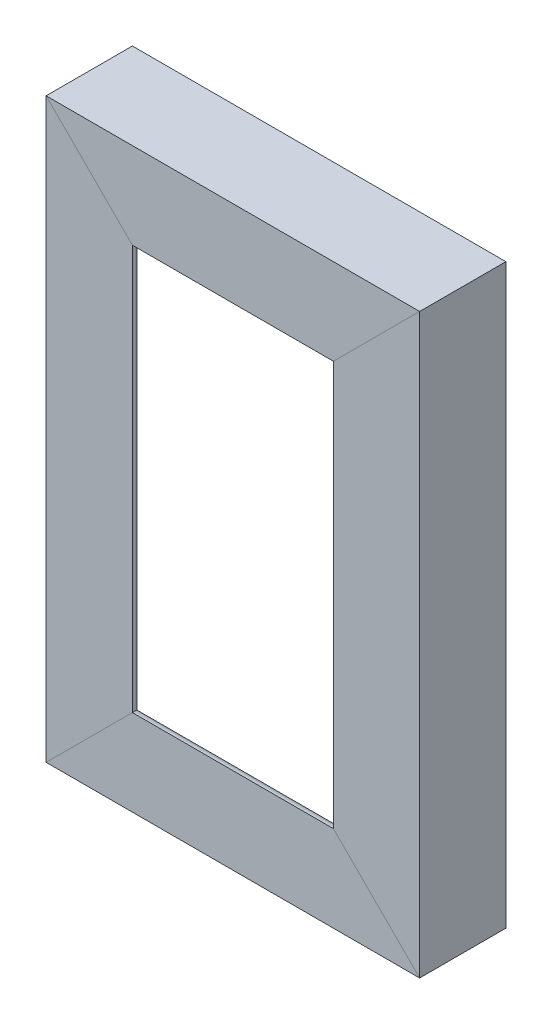
from build123d import *

# Parameters (mm, degrees)
HIERRO_ANGULAR_1_X_1_X_0_125_1_DEPTH      = 206.921024484
HIERRO_ANGULAR_1_X_1_X_0_125_1_DEPTH_BACK = 36.921024484
HIERRO_ANGULAR_1_X_1_X_0_125_1_2_DEPTH    = 183.842048969
HIERRO_ANGULAR_1_X_1_X_0_125_1_3_DEPTH    = 243.842048969
HIERRO_ANGULAR_1_X_1_X_0_125_1_4_DEPTH    = 183.842048969


with BuildPart() as part:
    # Sketch1 → Hierro angular 1 X 1 X 0.125(1) (new, two sides: drawn at the far end of the back side and taken through both)
    with BuildSketch(Plane(origin=(-55, -85, 0), x_dir=(1, 0, 0), z_dir=(0, 1, 0)).offset(-HIERRO_ANGULAR_1_X_1_X_0_125_1_DEPTH_BACK)):
        with BuildLine():
            Line((0, 0), (0, 25.4))
            Line((0, 25.4), (0.00508, 25.4))
            ThreePointArc((0.00508, 25.4), (2.246551928, 24.471551928), (3.175, 22.23008))
            Line((3.175, 22.23008), (3.175, 7.9375))
            ThreePointArc((3.175, 7.9375), (4.569903955, 4.569903955), (7.9375, 3.175))
            Line((7.9375, 3.175), (22.23008, 3.175))
            ThreePointArc((22.23008, 3.175), (24.471551928, 2.246551928), (25.4, 0.00508))
            Line((25.4, 0.00508), (25.4, 0))
            Line((25.4, 0), (0, 0))
        make_face()
    extrude(amount=HIERRO_ANGULAR_1_X_1_X_0_125_1_DEPTH + HIERRO_ANGULAR_1_X_1_X_0_125_1_DEPTH_BACK)

    # Hierro angular 1 X 1 X 0.125(1) mitre 1
    split(bisect_by=Plane(origin=(-55, -85, 0), x_dir=(-0.707106781, -0.707106781, 0), z_dir=(-0.707106781, 0.707106781, 0)), keep=Keep.TOP)

    # Hierro angular 1 X 1 X 0.125(1) mitre 2
    split(bisect_by=Plane(origin=(-55, 85, 0), x_dir=(0.707106781, -0.707106781, 0), z_dir=(-0.707106781, -0.707106781, 0)), keep=Keep.TOP)


with BuildPart() as body_2:
    # Sketch1 on segment 2 (carried to segment 2) → Hierro angular 1 X 1 X 0.125_1 2 (new body)
    with BuildSketch(Plane(origin=(-91.921024484, 85, 0), x_dir=(0, -1, 0), z_dir=(1, 0, 0))):
        with BuildLine():
            Line((0, 0), (0, 25.4))
            Line((0, 25.4), (0.00508, 25.4))
            ThreePointArc((0.00508, 25.4), (2.246551928, 24.471551928), (3.175, 22.23008))
            Line((3.175, 22.23008), (3.175, 7.9375))
            ThreePointArc((3.175, 7.9375), (4.569903955, 4.569903955), (7.9375, 3.175))
            Line((7.9375, 3.175), (22.23008, 3.175))
            ThreePointArc((22.23008, 3.175), (24.471551928, 2.246551928), (25.4, 0.00508))
            Line((25.4, 0.00508), (25.4, 0))
            Line((25.4, 0), (0, 0))
        make_face()
    extrude(amount=HIERRO_ANGULAR_1_X_1_X_0_125_1_2_DEPTH)

    # Hierro angular 1 X 1 X 0.125_1 2 mitre 1
    split(bisect_by=Plane(origin=(55, 85, 0), x_dir=(-0.707106781, -0.707106781, 0), z_dir=(-0.707106781, 0.707106781, 0)), keep=Keep.TOP)

    # Hierro angular 1 X 1 X 0.125_1 2 mitre 2
    split(bisect_by=Plane(origin=(-55, 85, 0), x_dir=(-0.707106781, 0.707106781, 0), z_dir=(0.707106781, 0.707106781, 0)), keep=Keep.TOP)


with BuildPart() as body_3:
    # Sketch1 on segment 3 (carried to segment 3) → Hierro angular 1 X 1 X 0.125_1 3 (new body)
    with BuildSketch(Plane(origin=(55, 121.921024484, 0), x_dir=(-1, 0, 0), z_dir=(0, -1, 0))):
        with BuildLine():
            Line((0, 0), (0, 25.4))
            Line((0, 25.4), (0.00508, 25.4))
            ThreePointArc((0.00508, 25.4), (2.246551928, 24.471551928), (3.175, 22.23008))
            Line((3.175, 22.23008), (3.175, 7.9375))
            ThreePointArc((3.175, 7.9375), (4.569903955, 4.569903955), (7.9375, 3.175))
            Line((7.9375, 3.175), (22.23008, 3.175))
            ThreePointArc((22.23008, 3.175), (24.471551928, 2.246551928), (25.4, 0.00508))
            Line((25.4, 0.00508), (25.4, 0))
            Line((25.4, 0), (0, 0))
        make_face()
    extrude(amount=HIERRO_ANGULAR_1_X_1_X_0_125_1_3_DEPTH)

    # Hierro angular 1 X 1 X 0.125_1 3 mitre 1
    split(bisect_by=Plane(origin=(55, -85, 0), x_dir=(-0.707106781, 0.707106781, 0), z_dir=(0.707106781, 0.707106781, 0)), keep=Keep.TOP)

    # Hierro angular 1 X 1 X 0.125_1 3 mitre 2
    split(bisect_by=Plane(origin=(55, 85, 0), x_dir=(0.707106781, 0.707106781, 0), z_dir=(0.707106781, -0.707106781, 0)), keep=Keep.TOP)


with BuildPart() as body_4:
    # Sketch1 on segment 4 (carried to segment 4) → Hierro angular 1 X 1 X 0.125_1 4 (new body)
    with BuildSketch(Plane(origin=(91.921024484, -85, 0), x_dir=(0, 1, 0), z_dir=(-1, 0, 0))):
        with BuildLine():
            Line((0, 0), (0, 25.4))
            Line((0, 25.4), (0.00508, 25.4))
            ThreePointArc((0.00508, 25.4), (2.246551928, 24.471551928), (3.175, 22.23008))
            Line((3.175, 22.23008), (3.175, 7.9375))
            ThreePointArc((3.175, 7.9375), (4.569903955, 4.569903955), (7.9375, 3.175))
            Line((7.9375, 3.175), (22.23008, 3.175))
            ThreePointArc((22.23008, 3.175), (24.471551928, 2.246551928), (25.4, 0.00508))
            Line((25.4, 0.00508), (25.4, 0))
            Line((25.4, 0), (0, 0))
        make_face()
    extrude(amount=HIERRO_ANGULAR_1_X_1_X_0_125_1_4_DEPTH)

    # Hierro angular 1 X 1 X 0.125_1 4 mitre 1
    split(bisect_by=Plane(origin=(55, -85, 0), x_dir=(0.707106781, -0.707106781, 0), z_dir=(-0.707106781, -0.707106781, 0)), keep=Keep.TOP)

    # Hierro angular 1 X 1 X 0.125_1 4 mitre 2
    split(bisect_by=Plane(origin=(-55, -85, 0), x_dir=(0.707106781, 0.707106781, 0), z_dir=(0.707106781, -0.707106781, 0)), keep=Keep.TOP)


solid = Compound([part.part, body_2.part, body_3.part, body_4.part])
